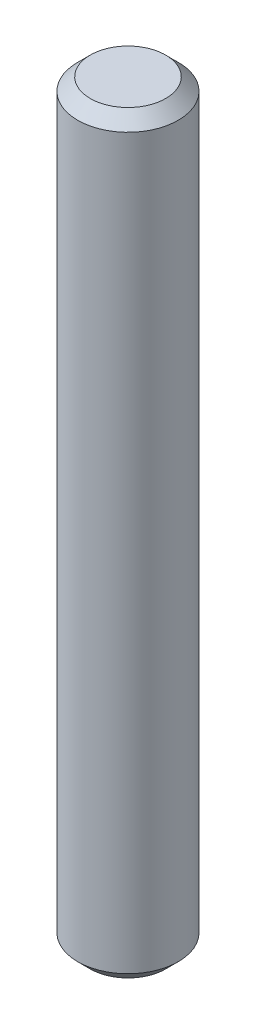
from build123d import *

# Parameters (mm, degrees)
SKETCH2_R           = 2
BOSS_EXTRUDE1_DEPTH = 15
CHAMFER1_SIZE       = 0.5


with BuildPart() as part:
    # Sketch2 → Boss-Extrude1 (new, symmetric)
    with BuildSketch(Plane(origin=(0, 0, 0), x_dir=(1, 0, 0), z_dir=(0, 1, 0))):
        with Locations(Location((0, 0, 0), (0, 0, 270))):
            Circle(SKETCH2_R)
    extrude(amount=BOSS_EXTRUDE1_DEPTH, both=True)

    # Chamfer1
    chamfer1_edges = [part.edges().sort_by_distance(p)[0] for p in [
        (0, -15, -2),
        (0, 15, -2),
    ]]
    chamfer(chamfer1_edges, length=CHAMFER1_SIZE)


solid = part.part
